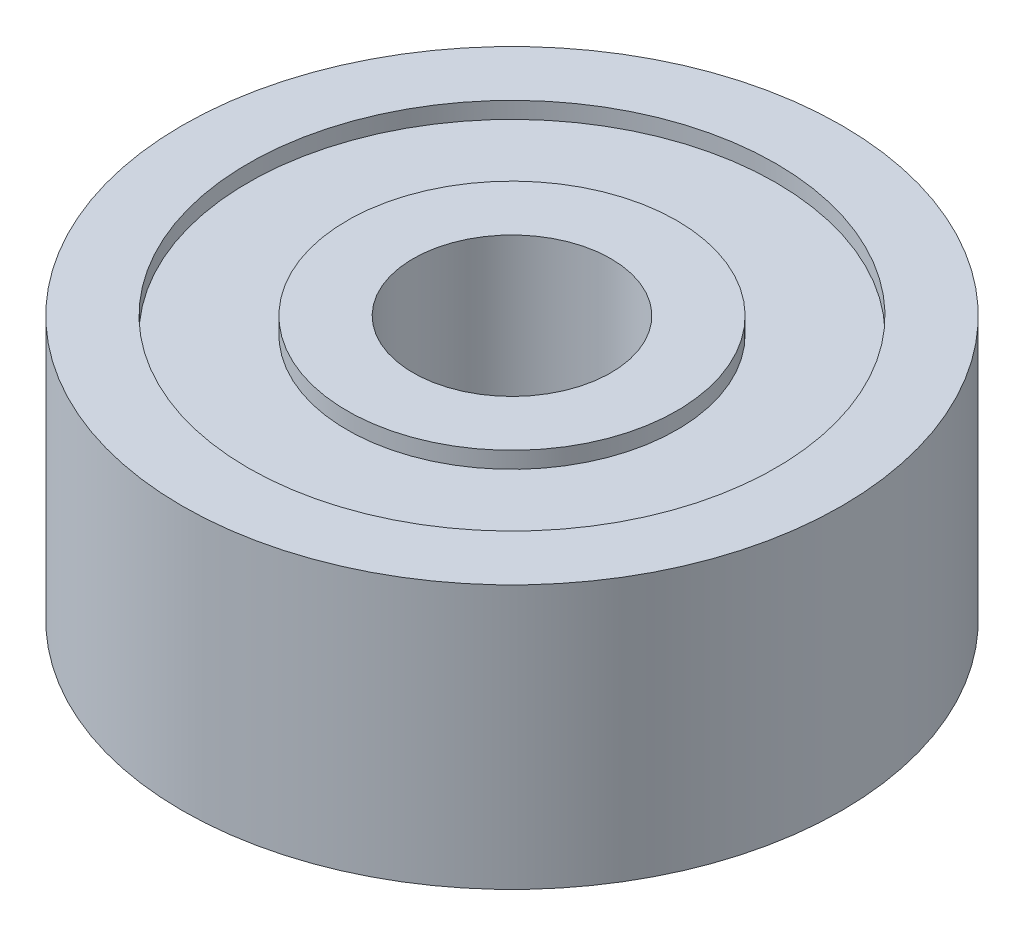
from build123d import *


with BuildPart() as part:
    # Sketch1 → Revolve1 (revolve)
    with BuildSketch(Plane.XY, mode=Mode.PRIVATE) as revolve1_sk:
        Polygon((1.5, 4), (1.5, 0), (2.5, 0), (2.5, 0.25), (4, 0.25), (4, 0), (5, 0), (5, 4), (4, 4), (4, 3.75), (2.5, 3.75), (2.5, 4), align=None)
    revolve(revolve1_sk.sketch.rotate(Axis((0, 0, 0), (0, 1, 0)), 90), axis=Axis((0, 0, 0), (0, 1, 0)))


solid = part.part
